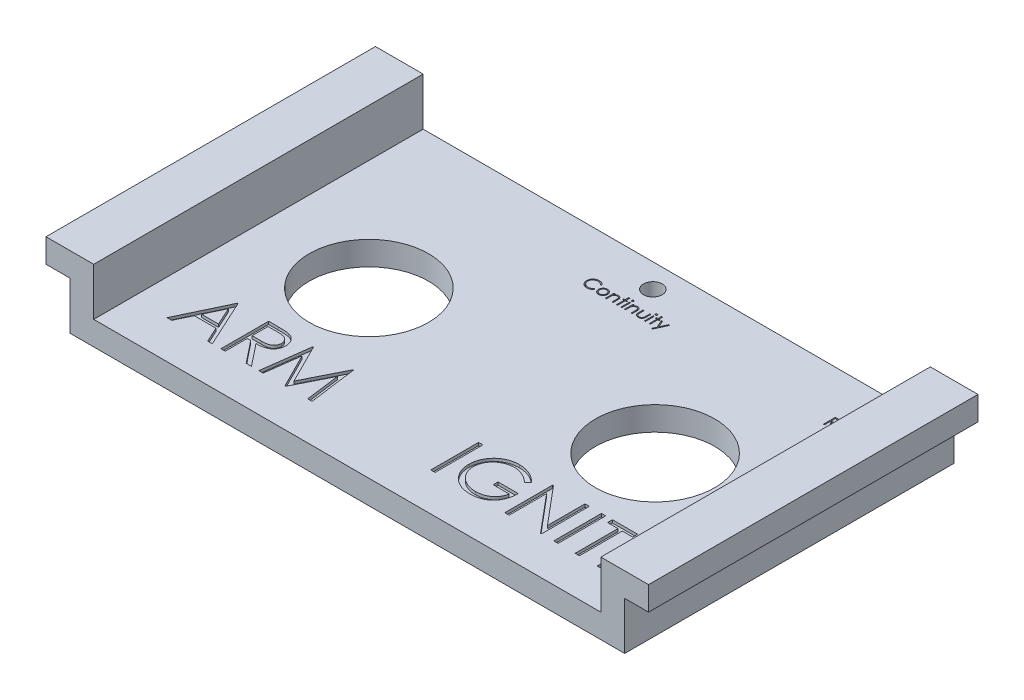
from build123d import *

# Parameters (mm, degrees)
IZIM1_W                     = 147.7
IZIM1_H                     = 87.7
Y_KSEKLIK_EKSTR_ZYON1_DEPTH = 6.35
IZIM2_W                     = 87.700000114
IZIM2_H                     = 12.7
Y_KSEKLIK_EKSTR_ZYON2_DEPTH = 6.35
IZIM3_W                     = 87.7
IZIM3_H                     = 12.7
Y_KSEKLIK_EKSTR_ZYON3_DEPTH = 6.35
IZIM6_W                     = 87.7
IZIM6_H                     = 6.35
Y_KSEKLIK_EKSTR_ZYON4_DEPTH = 6.35
IZIM4_W                     = 87.7
IZIM4_H                     = 6.35
Y_KSEKLIK_EKSTR_ZYON5_DEPTH = 6.35
IZIM7_R                     = 15.875
KES_EKSTR_ZYON1_DEPTH       = 6.35
IZIM8_R                     = 15.875
KES_EKSTR_ZYON2_DEPTH       = 6.35
IZIM9_R                     = 2.5
KES_EKSTR_ZYON3_DEPTH       = 6.35
IZIM10_R                    = 2.5
KES_EKSTR_ZYON4_DEPTH       = 6.35
IZIM11_W                    = 0.284935897
IZIM11_H                    = 2.320192308
KES_EKSTR_ZYON5_DEPTH       = 0.762
IZIM12_W                    = 0.284935897
IZIM12_H                    = 2.320192308
KES_EKSTR_ZYON6_DEPTH       = 0.762
KES_EKSTR_ZYON7_DEPTH       = 0.762
IZIM14_W                    = 1.139743589
IZIM14_H                    = 12.7
KES_EKSTR_ZYON8_DEPTH       = 0.762


with BuildPart() as part:
    # Çizim1 → Yükseklik-Ekstrüzyon1 (new body)
    with BuildSketch(Plane(origin=(0, 0, 0), x_dir=(1, 0, 0), z_dir=(0, 1, 0))):
        Rectangle(IZIM1_W, IZIM1_H)
    extrude(amount=Y_KSEKLIK_EKSTR_ZYON1_DEPTH)

    # Çizim2 → Yükseklik-Ekstrüzyon2 (add)
    with BuildSketch(Plane.ZY.offset(73.85)):
        with Locations((5.7e-08, 12.7)):
            Rectangle(IZIM2_W, IZIM2_H)
    extrude(amount=-Y_KSEKLIK_EKSTR_ZYON2_DEPTH)

    # Çizim3 → Yükseklik-Ekstrüzyon3 (add)
    with BuildSketch(Plane(origin=(73.85, 0, 0), x_dir=(0, 0, -1), z_dir=(1, 0, 0))):
        with Locations((0, 12.7)):
            Rectangle(IZIM3_W, IZIM3_H)
    extrude(amount=-Y_KSEKLIK_EKSTR_ZYON3_DEPTH)

    # Çizim6 → Yükseklik-Ekstrüzyon4 (add)
    with BuildSketch(Plane.ZY.offset(73.85)):
        with Locations((0, 15.875)):
            Rectangle(IZIM6_W, IZIM6_H)
    extrude(amount=Y_KSEKLIK_EKSTR_ZYON4_DEPTH)

    # Çizim4 → Yükseklik-Ekstrüzyon5 (add)
    with BuildSketch(Plane(origin=(73.85, 0, 0), x_dir=(0, 0, -1), z_dir=(1, 0, 0))):
        with Locations((0, 15.875)):
            Rectangle(IZIM4_W, IZIM4_H)
    extrude(amount=Y_KSEKLIK_EKSTR_ZYON5_DEPTH)

    # Çizim7 → Kes-Ekstrüzyon1 (cut)
    with BuildSketch(Plane(origin=(0, 6.35, 0), x_dir=(1, 0, 0), z_dir=(0, 1, 0))):
        with Locations(Location((-38.1, 0, 0), (0, 0, 270))):
            Circle(IZIM7_R)
    extrude(amount=-KES_EKSTR_ZYON1_DEPTH, mode=Mode.SUBTRACT)

    # Çizim8 → Kes-Ekstrüzyon2 (cut)
    with BuildSketch(Plane(origin=(0, 6.35, 0), x_dir=(1, 0, 0), z_dir=(0, 1, 0))):
        with Locations(Location((38.1, 0, 0), (0, 0, 270))):
            Circle(IZIM8_R)
    extrude(amount=-KES_EKSTR_ZYON2_DEPTH, mode=Mode.SUBTRACT)

    # Çizim9 → Kes-Ekstrüzyon3 (cut)
    with BuildSketch(Plane(origin=(0, 6.35, 0), x_dir=(1, 0, 0), z_dir=(0, 1, 0))):
        with Locations(Location((61.15, 37.5, 0), (0, 0, 270))):
            Circle(IZIM9_R)
    extrude(amount=-KES_EKSTR_ZYON3_DEPTH, mode=Mode.SUBTRACT)

    # Çizim10 → Kes-Ekstrüzyon4 (cut)
    with BuildSketch(Plane(origin=(0, 6.35, 0), x_dir=(1, 0, 0), z_dir=(0, 1, 0))):
        with Locations(Location((0, 37.5, 0), (0, 0, 270))):
            Circle(IZIM10_R)
    extrude(amount=-KES_EKSTR_ZYON4_DEPTH, mode=Mode.SUBTRACT)

    # Çizim11 → Kes-Ekstrüzyon5 (cut)
    # profile 1 of 12: a face of its own
    with BuildSketch(Plane(origin=(0, 6.35, 0), x_dir=(1, 0, 0), z_dir=(0, 1, 0))):
        with BuildLine():
            Line((-7.736114872, 31.710407853), (-7.985433783, 31.519602564))
            add(Edge.make_bspline(
                [(-7.985433783, 31.519602564), (-8.003219124, 31.540798837), (-8.038550022, 31.58290561), (-8.09539087, 31.642032768), (-8.154628789, 31.697427684), (-8.216241135, 31.749354246), (-8.281336908, 31.795996598), (-8.348339203, 31.839785384), (-8.418368859, 31.879035404), (-8.515207932, 31.926626827), (-8.64188848, 31.97628941), (-8.801359513, 32.017930199), (-8.967830295, 32.04443798), (-9.081402403, 32.047308943), (-9.13916976, 32.048769231)],
                knots=[0, 0, 0, 0, 0.757959112, 1.505699292, 2.245454638, 2.979532153, 3.711538275, 4.438200793, 5.171680507, 5.909471876, 7.393775596, 8.890124382, 10.418191784, 12, 12, 12, 12], degree=3))
            add(Edge.make_bspline(
                [(-9.13916976, 32.048769231), (-9.170995324, 32.048402779), (-9.234351082, 32.047673277), (-9.328375054, 32.038049285), (-9.420643322, 32.024522687), (-9.511095867, 32.004451858), (-9.59961755, 31.979076696), (-9.686787087, 31.948755071), (-9.771342416, 31.911240323), (-9.854453247, 31.869776402), (-9.934081531, 31.822942934), (-10.009424324, 31.771858679), (-10.080206838, 31.717095284), (-10.146485065, 31.658447495), (-10.208326761, 31.596179431), (-10.265283821, 31.529627492), (-10.317159158, 31.459004449), (-10.364981031, 31.385241573), (-10.407809724, 31.308553719), (-10.443668972, 31.228657048), (-10.475423619, 31.146919754), (-10.500550789, 31.062418344), (-10.520439458, 30.975747406), (-10.534162409, 30.886674334), (-10.543676951, 30.795385211), (-10.544402826, 30.73350962), (-10.544768718, 30.702319912)],
                knots=[0, 0, 0, 0, 1.054917814, 2.100044995, 3.131103042, 4.146048494, 5.169673617, 6.183595914, 7.203665975, 8.234915748, 9.262203917, 10.264457458, 11.251630812, 12.227803204, 13.197192746, 14.159520551, 15.12972552, 16.100847026, 17.073214652, 18.039054194, 19.002613845, 19.979014051, 20.95965708, 21.949030935, 22.966165397, 24, 24, 24, 24], degree=3))
            add(Edge.make_bspline(
                [(-10.544768718, 30.702319912), (-10.543624068, 30.655392215), (-10.5413767, 30.563255905), (-10.521375711, 30.428299709), (-10.490981807, 30.299013097), (-10.445429105, 30.176204241), (-10.38925968, 30.058358801), (-10.318284268, 29.947470699), (-10.236082124, 29.841864244), (-10.141490329, 29.744035284), (-10.03770791, 29.654669262), (-9.926358019, 29.575974091), (-9.807717986, 29.510374162), (-9.683097758, 29.455785982), (-9.551538354, 29.413824522), (-9.413276355, 29.38428421), (-9.268612474, 29.365014518), (-9.169761661, 29.363169672), (-9.119453214, 29.362230769)],
                knots=[0, 0, 0, 0, 1.029171465, 2.020641659, 2.987623507, 3.938342917, 4.889210282, 5.84687017, 6.821220943, 7.821438502, 8.827599549, 9.822697543, 10.807740252, 11.797342354, 12.80366471, 13.83203677, 14.896651826, 16, 16, 16, 16], degree=3))
            add(Edge.make_bspline(
                [(-9.119453214, 29.362230769), (-9.064024346, 29.363762734), (-8.954927074, 29.366778006), (-8.794936079, 29.392322468), (-8.64177792, 29.433740722), (-8.495444359, 29.491705266), (-8.35634793, 29.567057348), (-8.22427096, 29.658404709), (-8.099101964, 29.766616268), (-8.023835158, 29.849241677), (-7.985433783, 29.891397436)],
                knots=[0, 0, 0, 0, 1.028121516, 2.023589091, 2.998037872, 3.967518031, 4.937445131, 5.927275754, 6.942489185, 8, 8, 8, 8], degree=3))
            Line((-7.985433783, 29.891397436), (-7.736114872, 29.7025002))
            add(Edge.make_bspline(
                [(-7.736114872, 29.7025002), (-7.756179158, 29.676611748), (-7.796211622, 29.624958846), (-7.861034251, 29.552140938), (-7.929321514, 29.483647992), (-8.001580622, 29.420032221), (-8.076980333, 29.36002067), (-8.156874502, 29.305318294), (-8.240212839, 29.255161564), (-8.326712973, 29.209235711), (-8.416283001, 29.168489351), (-8.508815595, 29.13360629), (-8.603911903, 29.103557283), (-8.701576271, 29.078835883), (-8.802011279, 29.059539972), (-8.904854495, 29.046640695), (-9.010327882, 29.037803387), (-9.081485457, 29.036997921), (-9.117545161, 29.036589744)],
                knots=[0, 0, 0, 0, 0.986787822, 1.968848986, 2.935600012, 3.899624008, 4.868462664, 5.837806735, 6.815139263, 7.798259679, 8.787526145, 9.778297419, 10.776456485, 11.791383307, 12.812564526, 13.85620153, 14.913611965, 16, 16, 16, 16], degree=3))
            add(Edge.make_bspline(
                [(-9.117545161, 29.036589744), (-9.151693344, 29.036827408), (-9.219217149, 29.037297361), (-9.318911017, 29.044910255), (-9.415965851, 29.055296803), (-9.510104261, 29.070936064), (-9.601839967, 29.089391287), (-9.690341354, 29.114130213), (-9.776479295, 29.141842671), (-9.859907719, 29.174413623), (-9.940697589, 29.211167589), (-10.018588332, 29.252707074), (-10.093544125, 29.298682766), (-10.166301899, 29.34808124), (-10.23578685, 29.402489221), (-10.30260112, 29.461151096), (-10.367119366, 29.523869149), (-10.407036087, 29.569094623), (-10.427105457, 29.591833133)],
                knots=[0, 0, 0, 0, 1.114604814, 2.203992996, 3.262667896, 4.300477797, 5.318619304, 6.316056647, 7.298880507, 8.271930387, 9.238335007, 10.195173496, 11.151986948, 12.108099108, 13.064862484, 14.031167946, 15.010108607, 16, 16, 16, 16], degree=3))
            add(Edge.make_bspline(
                [(-10.427105457, 29.591833133), (-10.459250648, 29.631331212), (-10.523152945, 29.709850513), (-10.604909815, 29.837109939), (-10.674893669, 29.969977528), (-10.73147754, 30.109151321), (-10.775712305, 30.254319022), (-10.806356675, 30.40555381), (-10.826269916, 30.562714444), (-10.828547106, 30.669609245), (-10.829704616, 30.723944511)],
                knots=[0, 0, 0, 0, 0.994628077, 1.977248131, 2.950237994, 3.925870899, 4.908910175, 5.911660606, 6.938484602, 8, 8, 8, 8], degree=3))
            add(Edge.make_bspline(
                [(-10.829704616, 30.723944511), (-10.828293833, 30.781054101), (-10.825518206, 30.893413654), (-10.801936306, 31.058308598), (-10.764000684, 31.216288795), (-10.710119221, 31.367059335), (-10.641806509, 31.511413232), (-10.557418081, 31.648247753), (-10.457934316, 31.778437993), (-10.344135451, 31.900008518), (-10.219342225, 32.011169216), (-10.085703016, 32.108964844), (-9.943479392, 32.190351447), (-9.794238198, 32.25838368), (-9.636861901, 32.310675443), (-9.471686274, 32.347281549), (-9.299021687, 32.370066361), (-9.181217915, 32.372946728), (-9.121361266, 32.374410256)],
                knots=[0, 0, 0, 0, 1.032925535, 2.032216505, 3.007276963, 3.968222605, 4.92396291, 5.891752235, 6.871517503, 7.883894988, 8.900124299, 9.891468569, 10.874487609, 11.85992873, 12.854644235, 13.869047385, 14.917252991, 16, 16, 16, 16], degree=3))
            add(Edge.make_bspline(
                [(-9.121361266, 32.374410256), (-9.084880996, 32.373972888), (-9.012671973, 32.373107162), (-8.905853495, 32.364665162), (-8.801856527, 32.350592104), (-8.700609422, 32.331436813), (-8.60161962, 32.307663028), (-8.505643688, 32.2766929), (-8.41211845, 32.24128119), (-8.321633755, 32.200497439), (-8.234623742, 32.154716895), (-8.15111551, 32.104447007), (-8.071772388, 32.049750098), (-7.996036076, 31.99109136), (-7.925173513, 31.92722981), (-7.857172743, 31.859921991), (-7.79434305, 31.787229165), (-7.755559795, 31.736061832), (-7.736114872, 31.710407853)],
                knots=[0, 0, 0, 0, 1.096760587, 2.17092713, 3.219439832, 4.250915756, 5.268269357, 6.278326846, 7.281116186, 8.274029601, 9.260640565, 10.235837813, 11.203064059, 12.156899882, 13.114053108, 14.069676657, 15.032185724, 16, 16, 16, 16], degree=3))
        make_face()
    # profile 2 of 12: a face of its own
    with BuildSketch(Plane(origin=(0, 6.35, 0), x_dir=(1, 0, 0), z_dir=(0, 1, 0))):
        with BuildLine():
            add(Edge.make_bspline(
                [(-6.045580016, 31.478897436), (-6.002045076, 31.477970435), (-5.916683697, 31.476152812), (-5.791672258, 31.456726379), (-5.672342028, 31.427019841), (-5.558235982, 31.385952067), (-5.450815485, 31.330904869), (-5.348515857, 31.265219298), (-5.25161757, 31.187402231), (-5.193539536, 31.127205983), (-5.164059584, 31.096650841)],
                knots=[0, 0, 0, 0, 1.054011418, 2.066658804, 3.057071809, 4.030435133, 4.997543892, 5.974964718, 6.972108034, 8, 8, 8, 8], degree=3))
            add(Edge.make_bspline(
                [(-5.164059584, 31.096650841), (-5.138675954, 31.067428154), (-5.088399938, 31.00954832), (-5.023933178, 30.915699299), (-4.968396477, 30.818507922), (-4.923889363, 30.716683562), (-4.88879652, 30.61111511), (-4.86388121, 30.501439714), (-4.849061276, 30.387899585), (-4.84706287, 30.31078896), (-4.84605077, 30.271735978)],
                knots=[0, 0, 0, 0, 1.025258237, 2.030674902, 3.01204498, 3.988269485, 4.97094183, 5.956517959, 6.965070386, 8, 8, 8, 8], degree=3))
            add(Edge.make_bspline(
                [(-4.84605077, 30.271735978), (-4.846940983, 30.23245664), (-4.848700086, 30.154838836), (-4.865340366, 30.040521268), (-4.891222137, 29.929673108), (-4.928262447, 29.822758435), (-4.975758732, 29.719450442), (-5.033716713, 29.620200351), (-5.102543108, 29.524812344), (-5.18056102, 29.434096391), (-5.26678665, 29.350488468), (-5.360327728, 29.277619252), (-5.45934603, 29.215188297), (-5.565158214, 29.164899549), (-5.676798006, 29.125248606), (-5.794506204, 29.097399306), (-5.918099946, 29.080561207), (-6.002488925, 29.078398966), (-6.045580016, 29.077294872)],
                knots=[0, 0, 0, 0, 0.998656419, 1.973391657, 2.932242238, 3.890759089, 4.846373663, 5.82037756, 6.809684879, 7.83454468, 8.860553229, 9.859544525, 10.845671541, 11.83227036, 12.833544569, 13.85385346, 14.904124723, 16, 16, 16, 16], degree=3))
            add(Edge.make_bspline(
                [(-6.045580016, 29.077294872), (-6.088882226, 29.078402671), (-6.173691792, 29.080572352), (-6.29772179, 29.097333887), (-6.415640944, 29.125235772), (-6.527426887, 29.165029854), (-6.633693998, 29.215189905), (-6.733286035, 29.277430509), (-6.826903101, 29.350510078), (-6.913146973, 29.434090535), (-6.991159993, 29.524813853), (-7.059987651, 29.620199959), (-7.117945304, 29.719450544), (-7.165441674, 29.822758408), (-7.202481962, 29.929673115), (-7.228363739, 30.040521266), (-7.245004018, 30.154838836), (-7.246763121, 30.23245664), (-7.247653334, 30.271735978)],
                knots=[0, 0, 0, 0, 1.099876186, 2.154163076, 3.173186993, 4.173200201, 5.163417411, 6.152872554, 7.150605724, 8.17532212, 9.198891216, 10.186952605, 11.159729845, 12.11414092, 13.071450619, 14.029093627, 15.002601286, 16, 16, 16, 16], degree=3))
            add(Edge.make_bspline(
                [(-7.247653334, 30.271735978), (-7.246634331, 30.310576701), (-7.24461688, 30.387474659), (-7.229811847, 30.50080135), (-7.204993728, 30.610291124), (-7.169858818, 30.715452092), (-7.124941466, 30.816830237), (-7.070185155, 30.914261763), (-7.005060796, 31.00768641), (-6.95498474, 31.06549144), (-6.92964452, 31.094742788)],
                knots=[0, 0, 0, 0, 1.031353054, 2.041901799, 3.029428768, 4.008703097, 4.981709435, 5.96992636, 6.972712378, 8, 8, 8, 8], degree=3))
            add(Edge.make_bspline(
                [(-6.92964452, 31.094742788), (-6.900209012, 31.125562912), (-6.842318907, 31.186176108), (-6.744938275, 31.263766326), (-6.642890309, 31.330818764), (-6.534282698, 31.384772189), (-6.420270391, 31.427261415), (-6.300328649, 31.45680299), (-6.174893003, 31.476082819), (-6.089113918, 31.47794988), (-6.045580016, 31.478897436)],
                knots=[0, 0, 0, 0, 1.027980169, 2.021703884, 2.998553061, 3.971491411, 4.943284454, 5.930300938, 6.949603206, 8, 8, 8, 8], degree=3))
        make_face()
        with BuildLine():
            add(Edge.make_bspline(
                [(-6.046852052, 31.193961538), (-6.077638313, 31.193086516), (-6.138416094, 31.19135906), (-6.227878146, 31.178220089), (-6.314002429, 31.157403425), (-6.396952337, 31.127826888), (-6.476448144, 31.089637172), (-6.552565959, 31.042730303), (-6.625529672, 30.987727549), (-6.693911973, 30.924714983), (-6.756670213, 30.855881895), (-6.811532377, 30.782540884), (-6.858182295, 30.705881555), (-6.897044439, 30.625824192), (-6.925988817, 30.541557503), (-6.947010059, 30.454035787), (-6.960136634, 30.363080731), (-6.961847849, 30.30124895), (-6.962717436, 30.269827925)],
                knots=[0, 0, 0, 0, 1.021534396, 2.016698045, 2.994645724, 3.958388632, 4.93408049, 5.916473867, 6.921342795, 7.962252576, 8.998418191, 10.008913653, 10.997312074, 11.973003931, 12.956656626, 13.948281152, 14.957379055, 16, 16, 16, 16], degree=3))
            add(Edge.make_bspline(
                [(-6.962717436, 30.269827925), (-6.961259818, 30.229231443), (-6.958366717, 30.148655018), (-6.934839753, 30.029990642), (-6.895482199, 29.916069962), (-6.842335167, 29.807560812), (-6.77574524, 29.707165246), (-6.697289115, 29.617656113), (-6.607808815, 29.540380413), (-6.50837099, 29.476262789), (-6.401006716, 29.425317867), (-6.287381339, 29.389214511), (-6.168871567, 29.36574519), (-6.087881189, 29.363412495), (-6.046852052, 29.362230769)],
                knots=[0, 0, 0, 0, 1.016792936, 2.018143844, 3.017858371, 4.030088057, 5.03801393, 6.028138512, 7.003788237, 7.991172063, 8.984598303, 9.972568034, 10.972917682, 12, 12, 12, 12], degree=3))
            add(Edge.make_bspline(
                [(-6.046852052, 29.362230769), (-6.005825274, 29.363419381), (-5.924839555, 29.365765666), (-5.806494445, 29.38909631), (-5.693179627, 29.425476059), (-5.585926869, 29.476205493), (-5.486534307, 29.540623898), (-5.396410461, 29.617219754), (-5.318624221, 29.707402319), (-5.252100165, 29.807693792), (-5.198082763, 29.91590174), (-5.15890943, 30.030011668), (-5.135325905, 30.148649663), (-5.132440439, 30.229229649), (-5.130986667, 30.269827925)],
                knots=[0, 0, 0, 0, 1.02726834, 2.027799167, 3.010890988, 4.004497153, 4.992059811, 5.971914811, 6.958719428, 7.966827853, 8.981595046, 9.981490638, 10.983022906, 12, 12, 12, 12], degree=3))
            add(Edge.make_bspline(
                [(-5.130986667, 30.269827925), (-5.131855955, 30.301249138), (-5.133566581, 30.363081288), (-5.146697441, 30.454033657), (-5.167702824, 30.541565319), (-5.196705648, 30.625795351), (-5.235398932, 30.706088837), (-5.282948451, 30.782315804), (-5.337586596, 30.856135956), (-5.401102127, 30.924492473), (-5.469413048, 30.987752114), (-5.542406333, 31.042751631), (-5.618411278, 31.089431021), (-5.697676135, 31.12815354), (-5.780636678, 31.157134341), (-5.866640288, 31.178340285), (-5.955720637, 31.191303535), (-6.016280627, 31.193069871), (-6.046852052, 31.193961538)],
                knots=[0, 0, 0, 0, 1.042956736, 2.052379634, 3.044323526, 4.02829302, 5.004299113, 5.996692471, 7.007513377, 8.048758398, 9.090003419, 10.095195979, 11.07790575, 12.047570684, 13.018257071, 13.989683339, 14.985167495, 16, 16, 16, 16], degree=3))
        make_face(mode=Mode.SUBTRACT)
    # profile 3 of 12: a face of its own
    with BuildSketch(Plane(origin=(0, 6.35, 0), x_dir=(1, 0, 0), z_dir=(0, 1, 0))):
        with BuildLine():
            Line((-4.276178975, 31.438192308), (-3.991243077, 31.438192308))
            Line((-3.991243077, 31.438192308), (-3.991243077, 31.019692708))
            add(Edge.make_bspline(
                [(-3.991243077, 31.019692708), (-3.960819651, 31.057650035), (-3.901781931, 31.131307553), (-3.803461858, 31.22811836), (-3.699554177, 31.307897243), (-3.590695216, 31.371491399), (-3.4767372, 31.419430838), (-3.358374769, 31.45405279), (-3.234899286, 31.474812599), (-3.150930118, 31.477525165), (-3.108450609, 31.478897436)],
                knots=[0, 0, 0, 0, 1.12780773, 2.188550248, 3.19190651, 4.159438251, 5.104880172, 6.052711206, 7.014878035, 8, 8, 8, 8], degree=3))
            add(Edge.make_bspline(
                [(-3.108450609, 31.478897436), (-3.065514963, 31.477314294), (-2.981479546, 31.474215704), (-2.859125876, 31.449707706), (-2.744850011, 31.407847367), (-2.639059414, 31.350504989), (-2.543694014, 31.279197688), (-2.459942184, 31.196123558), (-2.39066981, 31.100568682), (-2.344226488, 31.011919819), (-2.313632507, 30.933280699), (-2.294371744, 30.86592829), (-2.278015068, 30.79089111), (-2.263834839, 30.708395911), (-2.254239888, 30.617864696), (-2.246672238, 30.519668575), (-2.241248708, 30.413839357), (-2.241033527, 30.340645059), (-2.240922565, 30.302900841)],
                knots=[0, 0, 0, 0, 1.235846778, 2.418850247, 3.575807741, 4.728682307, 5.871620074, 6.994088408, 8.11269785, 9.256955736, 9.865816715, 10.540099792, 11.271859618, 12.076849838, 12.949306005, 13.892391288, 14.913166135, 16, 16, 16, 16], degree=3))
            Line((-2.240922565, 30.302900841), (-2.240922565, 29.118))
            Line((-2.240922565, 29.118), (-2.525858462, 29.118))
            Line((-2.525858462, 29.118), (-2.525858462, 30.20940625))
            add(Edge.make_bspline(
                [(-2.525858462, 30.20940625), (-2.526033729, 30.240995182), (-2.526368986, 30.301419433), (-2.527426394, 30.387932762), (-2.52997529, 30.466388443), (-2.533556974, 30.536598912), (-2.53879938, 30.59849675), (-2.544262767, 30.652208022), (-2.550943853, 30.697664536), (-2.556897353, 30.725028575), (-2.559567396, 30.737300881)],
                knots=[0, 0, 0, 0, 1.430800155, 2.736877192, 3.918605307, 4.986035426, 5.920637409, 6.731861385, 7.431261377, 8, 8, 8, 8], degree=3))
            add(Edge.make_bspline(
                [(-2.559567396, 30.737300881), (-2.569206271, 30.773324599), (-2.587758123, 30.84265911), (-2.633599665, 30.936706559), (-2.691488244, 31.016714915), (-2.762152721, 31.082189512), (-2.844910526, 31.133144486), (-2.939532005, 31.16849943), (-3.045104058, 31.190612189), (-3.119357676, 31.192813944), (-3.158059984, 31.193961538)],
                knots=[0, 0, 0, 0, 1.084156227, 2.086665306, 3.027808233, 3.945421172, 4.874247719, 5.839848303, 6.874090471, 8, 8, 8, 8], degree=3))
            add(Edge.make_bspline(
                [(-3.158059984, 31.193961538), (-3.180981383, 31.193529734), (-3.226342239, 31.192675205), (-3.293606856, 31.184101527), (-3.358852356, 31.1700785), (-3.422733546, 31.151147664), (-3.483972759, 31.125146892), (-3.544537509, 31.095638106), (-3.602147216, 31.058855085), (-3.658030298, 31.017860735), (-3.710021202, 30.97243174), (-3.758397623, 30.92449422), (-3.801521399, 30.873444208), (-3.84059084, 30.820104256), (-3.874316836, 30.763741803), (-3.903756423, 30.704900611), (-3.928735232, 30.643503233), (-3.941147388, 30.600890141), (-3.947357861, 30.57956851)],
                knots=[0, 0, 0, 0, 1.023777757, 2.026029729, 3.023749952, 4.003683103, 4.997618607, 5.993177895, 7.010360494, 8.046726602, 9.087585522, 10.09234134, 11.086953743, 12.070360549, 13.043493632, 14.017870808, 15.008233677, 16, 16, 16, 16], degree=3))
            add(Edge.make_bspline(
                [(-3.947357861, 30.57956851), (-3.950931685, 30.563915575), (-3.958711713, 30.529839956), (-3.967114741, 30.473919662), (-3.974741613, 30.409231327), (-3.981125139, 30.33585044), (-3.985030767, 30.253520082), (-3.989289256, 30.162591857), (-3.990839618, 30.062703193), (-3.991104825, 29.993160086), (-3.991243077, 29.956907252)],
                knots=[0, 0, 0, 0, 0.615963638, 1.340920617, 2.168419149, 3.115676021, 4.16674242, 5.331190069, 6.6087489, 8, 8, 8, 8], degree=3))
            Line((-3.991243077, 29.956907252), (-3.991243077, 29.118))
            Line((-3.991243077, 29.118), (-4.276178975, 29.118))
            Line((-4.276178975, 29.118), (-4.276178975, 31.438192308))
        make_face()
    # profile 4 of 12: a face of its own
    with BuildSketch(Plane(origin=(0, 6.35, 0), x_dir=(1, 0, 0), z_dir=(0, 1, 0))):
        Polygon((-1.304704616, 32.374410256), (-1.019768718, 32.374410256), (-1.019768718, 31.438192308), (-0.612717436, 31.438192308), (-0.612717436, 31.15325641), (-1.019768718, 31.15325641), (-1.019768718, 29.118), (-1.304704616, 29.118), (-1.304704616, 31.15325641), (-1.711755898, 31.15325641), (-1.711755898, 31.438192308), (-1.304704616, 31.438192308), align=None)
    # profile 5 of 12: a face of its own
    with BuildSketch(Plane(origin=(0, 6.35, 0), x_dir=(1, 0, 0), z_dir=(0, 1, 0))):
        with BuildLine():
            add(Edge.make_bspline(
                [(-0.023765113, 32.415115385), (-0.006083705, 32.414295189), (0.028539888, 32.412689089), (0.078608066, 32.398935463), (0.124198356, 32.375622177), (0.164636728, 32.344344181), (0.199336654, 32.307560043), (0.223630584, 32.264687593), (0.239244686, 32.218370114), (0.241130233, 32.18606214), (0.242090256, 32.16961258)],
                knots=[0, 0, 0, 0, 1.055194115, 2.066272739, 3.074728998, 4.095836921, 5.109056067, 6.073838105, 7.019297344, 8, 8, 8, 8], degree=3))
            add(Edge.make_bspline(
                [(0.242090256, 32.16961258), (0.241108582, 32.15359003), (0.23916793, 32.121915346), (0.223642644, 32.076400839), (0.199129614, 32.034124096), (0.164658979, 31.997411381), (0.12419246, 31.966150675), (0.078609633, 31.942832805), (0.028539476, 31.929080395), (-0.006083844, 31.927474127), (-0.023765113, 31.926653846)],
                knots=[0, 0, 0, 0, 0.96129708, 1.900370562, 2.859976407, 3.87933698, 4.906634145, 5.921202961, 6.938410037, 8, 8, 8, 8], degree=3))
            add(Edge.make_bspline(
                [(-0.023765113, 31.926653846), (-0.041244191, 31.927442807), (-0.075264933, 31.928978415), (-0.124583426, 31.943102646), (-0.169784984, 31.966158655), (-0.210302223, 31.997206694), (-0.244075326, 32.034349565), (-0.268657379, 32.076375039), (-0.284146808, 32.121921915), (-0.286092293, 32.153592237), (-0.287076411, 32.16961258)],
                knots=[0, 0, 0, 0, 1.054934014, 2.053291228, 3.073705704, 4.106921865, 5.123545215, 6.088680038, 7.033164197, 8, 8, 8, 8], degree=3))
            add(Edge.make_bspline(
                [(-0.287076411, 32.16961258), (-0.286113854, 32.186059851), (-0.284223331, 32.218363328), (-0.268645768, 32.264713822), (-0.244280085, 32.307332756), (-0.21027986, 32.344548745), (-0.169790935, 32.375614247), (-0.124581888, 32.398665637), (-0.075265339, 32.412791066), (-0.041244329, 32.414326509), (-0.023765113, 32.415115385)],
                knots=[0, 0, 0, 0, 0.98631895, 1.937192651, 2.907499808, 3.917963147, 4.944918757, 5.95915025, 6.951458133, 8, 8, 8, 8], degree=3))
        make_face()
    # profile 6 of 12: a face of its own
    with BuildSketch(Plane(origin=(0, 6.35, 0), x_dir=(1, 0, 0), z_dir=(0, 1, 0))):
        with Locations((-0.022493077, 30.278096154)):
            Rectangle(IZIM11_W, IZIM11_H)
    # profile 7 of 12: a face of its own
    with BuildSketch(Plane(origin=(0, 6.35, 0), x_dir=(1, 0, 0), z_dir=(0, 1, 0))):
        with BuildLine():
            Line((0.811962051, 31.438192308), (1.096897948, 31.438192308))
            Line((1.096897948, 31.438192308), (1.096897948, 31.019692708))
            add(Edge.make_bspline(
                [(1.096897948, 31.019692708), (1.127321374, 31.057650035), (1.186359094, 31.131307553), (1.284679168, 31.22811836), (1.388586849, 31.307897243), (1.497445809, 31.371491399), (1.611403826, 31.419430838), (1.729766256, 31.45405279), (1.85324174, 31.474812599), (1.937210907, 31.477525165), (1.979690416, 31.478897436)],
                knots=[0, 0, 0, 0, 1.12780773, 2.188550248, 3.19190651, 4.159438251, 5.104880172, 6.052711206, 7.014878035, 8, 8, 8, 8], degree=3))
            add(Edge.make_bspline(
                [(1.979690416, 31.478897436), (2.022626063, 31.477314294), (2.10666148, 31.474215704), (2.22901515, 31.449707706), (2.343291014, 31.407847367), (2.449081611, 31.350504989), (2.544447012, 31.279197688), (2.628198842, 31.196123558), (2.697471216, 31.100568682), (2.743914538, 31.011919819), (2.774508519, 30.933280699), (2.793769282, 30.86592829), (2.810125958, 30.79089111), (2.824306186, 30.708395911), (2.833901138, 30.617864696), (2.841468788, 30.519668575), (2.846892318, 30.413839357), (2.847107499, 30.340645059), (2.847218461, 30.302900841)],
                knots=[0, 0, 0, 0, 1.235846778, 2.418850247, 3.575807741, 4.728682307, 5.871620074, 6.994088408, 8.11269785, 9.256955736, 9.865816715, 10.540099792, 11.271859618, 12.076849838, 12.949306005, 13.892391288, 14.913166135, 16, 16, 16, 16], degree=3))
            Line((2.847218461, 30.302900841), (2.847218461, 29.118))
            Line((2.847218461, 29.118), (2.562282564, 29.118))
            Line((2.562282564, 29.118), (2.562282564, 30.20940625))
            add(Edge.make_bspline(
                [(2.562282564, 30.20940625), (2.562107296, 30.240995182), (2.56177204, 30.301419433), (2.560714632, 30.387932762), (2.558165736, 30.466388443), (2.554584052, 30.536598912), (2.549341646, 30.59849675), (2.543878259, 30.652208022), (2.537197173, 30.697664536), (2.531243673, 30.725028575), (2.528573629, 30.737300881)],
                knots=[0, 0, 0, 0, 1.430800155, 2.736877192, 3.918605307, 4.986035426, 5.920637409, 6.731861385, 7.431261377, 8, 8, 8, 8], degree=3))
            add(Edge.make_bspline(
                [(2.528573629, 30.737300881), (2.518934754, 30.773324599), (2.500382902, 30.84265911), (2.45454136, 30.936706559), (2.396652782, 31.016714915), (2.325988304, 31.082189512), (2.2432305, 31.133144486), (2.148609021, 31.16849943), (2.043036968, 31.190612189), (1.968783349, 31.192813944), (1.930081041, 31.193961538)],
                knots=[0, 0, 0, 0, 1.084156227, 2.086665306, 3.027808233, 3.945421172, 4.874247719, 5.839848303, 6.874090471, 8, 8, 8, 8], degree=3))
            add(Edge.make_bspline(
                [(1.930081041, 31.193961538), (1.907159643, 31.193529734), (1.861798787, 31.192675205), (1.794534169, 31.184101527), (1.729288669, 31.1700785), (1.66540748, 31.151147664), (1.604168267, 31.125146892), (1.543603517, 31.095638106), (1.48599381, 31.058855085), (1.430110728, 31.017860735), (1.378119824, 30.97243174), (1.329743403, 30.92449422), (1.286619627, 30.873444208), (1.247550186, 30.820104256), (1.21382419, 30.763741803), (1.184384603, 30.704900611), (1.159405794, 30.643503233), (1.146993637, 30.600890141), (1.140783165, 30.57956851)],
                knots=[0, 0, 0, 0, 1.023777757, 2.026029729, 3.023749952, 4.003683103, 4.997618607, 5.993177895, 7.010360494, 8.046726602, 9.087585522, 10.09234134, 11.086953743, 12.070360549, 13.043493632, 14.017870808, 15.008233677, 16, 16, 16, 16], degree=3))
            add(Edge.make_bspline(
                [(1.140783165, 30.57956851), (1.137209341, 30.563915575), (1.129429312, 30.529839956), (1.121026285, 30.473919662), (1.113399413, 30.409231327), (1.107015886, 30.33585044), (1.103110259, 30.253520082), (1.09885177, 30.162591857), (1.097301407, 30.062703193), (1.097036201, 29.993160086), (1.096897948, 29.956907252)],
                knots=[0, 0, 0, 0, 0.615963638, 1.340920617, 2.168419149, 3.115676021, 4.16674242, 5.331190069, 6.6087489, 8, 8, 8, 8], degree=3))
            Line((1.096897948, 29.956907252), (1.096897948, 29.118))
            Line((1.096897948, 29.118), (0.811962051, 29.118))
            Line((0.811962051, 29.118), (0.811962051, 31.438192308))
        make_face()
    # profile 8 of 12: a face of its own
    with BuildSketch(Plane(origin=(0, 6.35, 0), x_dir=(1, 0, 0), z_dir=(0, 1, 0))):
        with BuildLine():
            Line((3.457795384, 31.438192308), (3.742731282, 31.438192308))
            Line((3.742731282, 31.438192308), (3.742731282, 30.362050481))
            add(Edge.make_bspline(
                [(3.742731282, 30.362050481), (3.74286001, 30.330461273), (3.74310626, 30.270032597), (3.744776257, 30.183078249), (3.74870427, 30.103778803), (3.753615382, 30.032088448), (3.759931034, 29.968019315), (3.767445226, 29.911795184), (3.775843937, 29.86277846), (3.784065113, 29.833256987), (3.787888533, 29.819527444)],
                knots=[0, 0, 0, 0, 1.388932606, 2.656963016, 3.823490214, 4.879454478, 5.816252168, 6.653371382, 7.373723809, 8, 8, 8, 8], degree=3))
            add(Edge.make_bspline(
                [(3.787888533, 29.819527444), (3.794022139, 29.802270982), (3.806161834, 29.768116817), (3.828181351, 29.718778219), (3.855421342, 29.673080642), (3.8852299, 29.629261947), (3.919610077, 29.588620145), (3.958126883, 29.551223867), (3.999490998, 29.515660155), (4.060954484, 29.473582523), (4.145009675, 29.428483616), (4.255366103, 29.389570981), (4.375022079, 29.36631563), (4.457721503, 29.363617556), (4.500228277, 29.362230769)],
                knots=[0, 0, 0, 0, 0.725840625, 1.436591201, 2.137033971, 2.831655856, 3.53531722, 4.242432219, 4.957935707, 5.694543706, 7.190802206, 8.724350549, 10.316345118, 12, 12, 12, 12], degree=3))
            add(Edge.make_bspline(
                [(4.500228277, 29.362230769), (4.542731102, 29.363647045), (4.624966204, 29.366387276), (4.743307497, 29.388869486), (4.851485566, 29.426430361), (4.948414643, 29.478869942), (5.033655084, 29.543043099), (5.104688378, 29.618343946), (5.163296388, 29.702390176), (5.188886362, 29.765095772), (5.201755721, 29.796630809)],
                knots=[0, 0, 0, 0, 1.157059328, 2.238695713, 3.266970494, 4.264342957, 5.228770407, 6.160125903, 7.074715775, 8, 8, 8, 8], degree=3))
            add(Edge.make_bspline(
                [(5.201755721, 29.796630809), (5.205560487, 29.809300237), (5.213971895, 29.837309249), (5.223009171, 29.884825163), (5.231150289, 29.941489483), (5.238101885, 30.007673001), (5.243059568, 30.083202761), (5.245732035, 30.168055158), (5.248751256, 30.261963821), (5.248797082, 30.327702431), (5.248821025, 30.362050481)],
                knots=[0, 0, 0, 0, 0.557542046, 1.232589297, 2.036731608, 2.971723315, 4.038036528, 5.22795436, 6.551621927, 8, 8, 8, 8], degree=3))
            Line((5.248821025, 30.362050481), (5.248821025, 31.438192308))
            Line((5.248821025, 31.438192308), (5.533756923, 31.438192308))
            Line((5.533756923, 31.438192308), (5.533756923, 30.308625))
            add(Edge.make_bspline(
                [(5.533756923, 30.308625), (5.533356242, 30.270246352), (5.532578868, 30.195786524), (5.52758292, 30.087578794), (5.519010772, 29.986738758), (5.505999908, 29.893213037), (5.490700331, 29.807073036), (5.470964284, 29.728208352), (5.447398311, 29.656861971), (5.420814022, 29.591781931), (5.389407042, 29.532775105), (5.355999674, 29.4767719), (5.317423631, 29.425161881), (5.276810633, 29.375375942), (5.231633416, 29.329890413), (5.182738544, 29.287661575), (5.130814213, 29.248043896), (5.074708155, 29.212582521), (5.015239441, 29.180635993), (4.952334656, 29.15231855), (4.885223322, 29.129909784), (4.814771309, 29.110577966), (4.740633445, 29.095415554), (4.662881202, 29.084723455), (4.581540772, 29.078169047), (4.526105762, 29.077591157), (4.497684206, 29.077294872)],
                knots=[0, 0, 0, 0, 1.493040784, 2.896703357, 4.213163133, 5.428574705, 6.569057535, 7.615249723, 8.588095153, 9.490268104, 10.346124644, 11.18633936, 12.024365274, 12.850166724, 13.684164916, 14.514361689, 15.362232829, 16.222528818, 17.093394965, 17.986930858, 18.902426812, 19.842810585, 20.827885679, 21.843828298, 22.894529745, 24, 24, 24, 24], degree=3))
            add(Edge.make_bspline(
                [(4.497684206, 29.077294872), (4.469475226, 29.077603035), (4.414041953, 29.078208604), (4.332697324, 29.084687243), (4.25472966, 29.095398941), (4.180416155, 29.110689031), (4.109682238, 29.129774473), (4.042241391, 29.152456252), (3.978883302, 29.180650689), (3.91884677, 29.21238033), (3.862601746, 29.248271687), (3.809888965, 29.287612694), (3.760779106, 29.330344623), (3.715261337, 29.376289011), (3.673974565, 29.426015804), (3.636404299, 29.47912499), (3.601972145, 29.535090342), (3.570809257, 29.595019068), (3.544037878, 29.660852249), (3.520402048, 29.733693187), (3.501070255, 29.81434047), (3.485338158, 29.902725148), (3.472682209, 29.998424221), (3.463895494, 30.101991284), (3.458982562, 30.213174061), (3.458199642, 30.289963605), (3.457795384, 30.329613582)],
                knots=[0, 0, 0, 0, 1.083640291, 2.129454052, 3.13281866, 4.105697902, 5.042300162, 5.946461698, 6.836384745, 7.703652036, 8.553297018, 9.397182691, 10.228592656, 11.052265423, 11.879314572, 12.708807002, 13.549817954, 14.402308542, 15.300838682, 16.27712199, 17.341985831, 18.484375296, 19.725102775, 21.0496083, 22.476576903, 24, 24, 24, 24], degree=3))
            Line((3.457795384, 30.329613582), (3.457795384, 31.438192308))
        make_face()
    # profile 9 of 12: a face of its own
    with BuildSketch(Plane(origin=(0, 6.35, 0), x_dir=(1, 0, 0), z_dir=(0, 1, 0))):
        with BuildLine():
            add(Edge.make_bspline(
                [(6.285529759, 32.415115385), (6.303211167, 32.414295189), (6.33783476, 32.412689089), (6.387902938, 32.398935463), (6.433493228, 32.375622177), (6.4739316, 32.344344181), (6.508631525, 32.307560043), (6.532925456, 32.264687593), (6.548539558, 32.218370114), (6.550425104, 32.18606214), (6.551385128, 32.16961258)],
                knots=[0, 0, 0, 0, 1.055194115, 2.066272739, 3.074728998, 4.095836921, 5.109056067, 6.073838105, 7.019297344, 8, 8, 8, 8], degree=3))
            add(Edge.make_bspline(
                [(6.551385128, 32.16961258), (6.550403454, 32.15359003), (6.548462802, 32.121915346), (6.532937516, 32.076400839), (6.508424486, 32.034124096), (6.473953851, 31.997411381), (6.433487332, 31.966150675), (6.387904504, 31.942832805), (6.337834348, 31.929080395), (6.303211028, 31.927474127), (6.285529759, 31.926653846)],
                knots=[0, 0, 0, 0, 0.96129708, 1.900370562, 2.859976407, 3.87933698, 4.906634145, 5.921202961, 6.938410037, 8, 8, 8, 8], degree=3))
            add(Edge.make_bspline(
                [(6.285529759, 31.926653846), (6.268050681, 31.927442807), (6.234029939, 31.928978415), (6.184711446, 31.943102646), (6.139509888, 31.966158655), (6.098992649, 31.997206694), (6.065219545, 32.034349565), (6.040637493, 32.076375039), (6.025148063, 32.121921915), (6.023202579, 32.153592237), (6.022218461, 32.16961258)],
                knots=[0, 0, 0, 0, 1.054934014, 2.053291228, 3.073705704, 4.106921865, 5.123545215, 6.088680038, 7.033164197, 8, 8, 8, 8], degree=3))
            add(Edge.make_bspline(
                [(6.022218461, 32.16961258), (6.023181018, 32.186059851), (6.025071541, 32.218363328), (6.040649104, 32.264713822), (6.065014786, 32.307332756), (6.099015012, 32.344548745), (6.139503937, 32.375614247), (6.184712984, 32.398665637), (6.234029533, 32.412791066), (6.268050543, 32.414326509), (6.285529759, 32.415115385)],
                knots=[0, 0, 0, 0, 0.98631895, 1.937192651, 2.907499808, 3.917963147, 4.944918757, 5.95915025, 6.951458133, 8, 8, 8, 8], degree=3))
        make_face()
    # profile 10 of 12: a face of its own
    with BuildSketch(Plane(origin=(0, 6.35, 0), x_dir=(1, 0, 0), z_dir=(0, 1, 0))):
        with Locations((6.286801795, 30.278096154)):
            Rectangle(IZIM11_W, IZIM11_H)
    # profile 11 of 12: a face of its own
    with BuildSketch(Plane(origin=(0, 6.35, 0), x_dir=(1, 0, 0), z_dir=(0, 1, 0))):
        Polygon((7.40619282, 32.374410256), (7.691128717, 32.374410256), (7.691128717, 31.438192308), (8.09818, 31.438192308), (8.09818, 31.15325641), (7.691128717, 31.15325641), (7.691128717, 29.118), (7.40619282, 29.118), (7.40619282, 31.15325641), (6.999141538, 31.15325641), (6.999141538, 31.438192308), (7.40619282, 31.438192308), align=None)
    # profile 12 of 12: a face of its own
    with BuildSketch(Plane(origin=(0, 6.35, 0), x_dir=(1, 0, 0), z_dir=(0, 1, 0))):
        Polygon((8.342410769, 31.438192308), (8.649607283, 31.438192308), (9.435089054, 29.661159054), (10.23265516, 31.438192308), (10.540487692, 31.438192308), (9.115808205, 28.263192308), (8.807975673, 28.263192308), (9.28053677, 29.315801482), align=None)
    extrude(amount=-KES_EKSTR_ZYON5_DEPTH, mode=Mode.SUBTRACT)

    # Çizim12 → Kes-Ekstrüzyon6 (cut)
    # profile 1 of 6: a face of its own
    with BuildSketch(Plane(origin=(0, 6.35, 0), x_dir=(1, 0, 0), z_dir=(0, 1, 0))):
        with BuildLine():
            Line((53.795098431, 32.293), (54.430480042, 32.293))
            add(Edge.make_bspline(
                [(54.430480042, 32.293), (54.472880923, 32.292858861), (54.554295311, 32.292587859), (54.670929635, 32.291076774), (54.776908501, 32.286745752), (54.872176498, 32.28301868), (54.956731878, 32.276222418), (55.030833921, 32.269726689), (55.094141332, 32.261223439), (55.132464354, 32.253326377), (55.149815979, 32.249750801)],
                knots=[0, 0, 0, 0, 1.410062039, 2.707475311, 3.878576406, 4.937260626, 5.877586885, 6.699081471, 7.410979367, 8, 8, 8, 8], degree=3))
            add(Edge.make_bspline(
                [(55.149815979, 32.249750801), (55.173044846, 32.244011521), (55.219007043, 32.232655396), (55.285183175, 32.208652758), (55.348242597, 32.180876384), (55.407923366, 32.148252152), (55.463926548, 32.110537888), (55.516829587, 32.068384662), (55.566872543, 32.022023126), (55.612031594, 31.970284377), (55.654612019, 31.916004114), (55.690524559, 31.857308563), (55.721482151, 31.795929892), (55.746129692, 31.731243877), (55.765976139, 31.663877841), (55.779969942, 31.593221576), (55.788362091, 31.519596977), (55.789216488, 31.469379445), (55.789649713, 31.443916466)],
                knots=[0, 0, 0, 0, 1.027469482, 2.033020251, 3.019912614, 3.986113645, 4.951240523, 5.91722682, 6.890402269, 7.87763091, 8.8651537, 9.85103654, 10.82876324, 11.815024772, 12.821070561, 13.842952187, 14.906261191, 16, 16, 16, 16], degree=3))
            add(Edge.make_bspline(
                [(55.789649713, 31.443916466), (55.788317122, 31.401611764), (55.785716892, 31.319064333), (55.761473405, 31.199266248), (55.721761848, 31.087515941), (55.667040007, 30.98395412), (55.597353768, 30.890599463), (55.513601993, 30.808602407), (55.41573796, 30.739986201), (55.324634224, 30.692404013), (55.244157771, 30.661930446), (55.177906123, 30.640488892), (55.105636793, 30.623922681), (55.028042211, 30.609081704), (54.944799467, 30.597876953), (54.856108074, 30.589670399), (54.761904779, 30.584541369), (54.697190052, 30.583777551), (54.663898511, 30.583384615)],
                knots=[0, 0, 0, 0, 1.260483769, 2.459530307, 3.627416485, 4.787058657, 5.939039949, 7.08810263, 8.267026773, 9.491475466, 10.141966685, 10.831826277, 11.566392101, 12.351337768, 13.187381173, 14.07005841, 15.007169909, 16, 16, 16, 16], degree=3))
            Line((54.663898511, 30.583384615), (55.830354842, 29.118))
            Line((55.830354842, 29.118), (55.478001076, 29.118))
            Line((55.478001076, 29.118), (54.311544745, 30.583384615))
            Line((54.311544745, 30.583384615), (54.080034329, 30.583384615))
            Line((54.080034329, 30.583384615), (54.080034329, 29.118))
            Line((54.080034329, 29.118), (53.795098431, 29.118))
            Line((53.795098431, 29.118), (53.795098431, 32.293))
        make_face()
        with BuildLine():
            Line((54.080034329, 31.967358974), (54.080034329, 30.909025641))
            Line((54.080034329, 30.909025641), (54.661354441, 30.904573518))
            add(Edge.make_bspline(
                [(54.661354441, 30.904573518), (54.688496191, 30.90456151), (54.741104632, 30.904538236), (54.81721452, 30.908161162), (54.888080622, 30.9122826), (54.953431876, 30.91858665), (55.013297476, 30.926711086), (55.067647501, 30.936873793), (55.116570669, 30.948713879), (55.173628629, 30.967039639), (55.237343197, 30.99607367), (55.306586736, 31.038315229), (55.365553142, 31.091445788), (55.415371488, 31.15220028), (55.455403187, 31.218998877), (55.483626265, 31.291040869), (55.50153548, 31.366507533), (55.503647804, 31.418376245), (55.504713816, 31.444552484)],
                knots=[0, 0, 0, 0, 1.146690395, 2.22261258, 3.21895312, 4.145990853, 4.996080663, 5.770904154, 6.481378293, 7.121626537, 8.300444488, 9.431385265, 10.535395872, 11.636531494, 12.74115979, 13.810798291, 14.895190096, 16, 16, 16, 16], degree=3))
            add(Edge.make_bspline(
                [(55.504713816, 31.444552484), (55.50362332, 31.470085447), (55.501462356, 31.520682464), (55.483819545, 31.59475604), (55.453984177, 31.664666773), (55.413777576, 31.73013027), (55.364792628, 31.78955333), (55.307354327, 31.840396105), (55.243033185, 31.882350976), (55.182915741, 31.909161022), (55.129181848, 31.925598317), (55.082527799, 31.937165444), (55.029812388, 31.946458641), (54.97077965, 31.953904525), (54.905681599, 31.960304367), (54.83418908, 31.964614909), (54.756776429, 31.967167486), (54.703121713, 31.967293659), (54.675346829, 31.967358974)],
                knots=[0, 0, 0, 0, 1.101028733, 2.181837193, 3.264309656, 4.369019818, 5.486613113, 6.575447106, 7.666700264, 8.788928104, 9.402425223, 10.0903467, 10.862060571, 11.710948788, 12.657782767, 13.684531032, 14.801375019, 16, 16, 16, 16], degree=3))
            Line((54.675346829, 31.967358974), (54.080034329, 31.967358974))
        make_face(mode=Mode.SUBTRACT)
    # profile 2 of 6: a face of its own
    with BuildSketch(Plane(origin=(0, 6.35, 0), x_dir=(1, 0, 0), z_dir=(0, 1, 0))):
        with BuildLine():
            Line((58.761124072, 31.438192308), (58.761124072, 29.118))
            Line((58.761124072, 29.118), (58.476188175, 29.118))
            Line((58.476188175, 29.118), (58.476188175, 29.519327123))
            add(Edge.make_bspline(
                [(58.476188175, 29.519327123), (58.444058272, 29.483005492), (58.381356362, 29.412123371), (58.276634777, 29.319520257), (58.165629358, 29.242977066), (58.048878874, 29.181155356), (57.926488753, 29.134716848), (57.798730303, 29.101709404), (57.665551407, 29.080487853), (57.5746082, 29.078368748), (57.528521909, 29.077294872)],
                knots=[0, 0, 0, 0, 1.074387032, 2.096679803, 3.090159297, 4.057316773, 5.018401886, 5.985159533, 6.978961417, 8, 8, 8, 8], degree=3))
            add(Edge.make_bspline(
                [(57.528521909, 29.077294872), (57.487548122, 29.078407367), (57.406746001, 29.080601256), (57.287883909, 29.097621345), (57.173500226, 29.124954124), (57.063486863, 29.162964216), (56.958555703, 29.213383962), (56.85780833, 29.273746379), (56.761766673, 29.345629132), (56.671894634, 29.427805415), (56.589134177, 29.517063725), (56.516507165, 29.612264328), (56.455952586, 29.712995561), (56.405315798, 29.817982065), (56.366311971, 29.928032028), (56.339121603, 30.042764887), (56.322121341, 30.162044987), (56.319928359, 30.243270126), (56.31881638, 30.28445633)],
                knots=[0, 0, 0, 0, 1.033919861, 2.038935746, 3.024066025, 3.998881131, 4.97069526, 5.957263378, 6.95902576, 7.993208707, 9.027059324, 10.027763471, 11.009749337, 11.988697705, 12.965288445, 13.950418724, 14.960734635, 16, 16, 16, 16], degree=3))
            add(Edge.make_bspline(
                [(56.31881638, 30.28445633), (56.319953004, 30.324791261), (56.322200049, 30.404531244), (56.338939755, 30.521805492), (56.367089313, 30.634761342), (56.406593432, 30.743035141), (56.457250062, 30.846757901), (56.518870541, 30.94600298), (56.591459319, 31.041043791), (56.675145431, 31.129645547), (56.765800544, 31.211488533), (56.862782035, 31.282616738), (56.963677441, 31.344045594), (57.070051743, 31.392716962), (57.180330474, 31.432095221), (57.295495385, 31.459339413), (57.415067317, 31.475393412), (57.496247978, 31.477718205), (57.537426156, 31.478897436)],
                knots=[0, 0, 0, 0, 1.020392517, 2.01726096, 2.990465484, 3.961182959, 4.928053699, 5.906110375, 6.912531644, 7.948652711, 8.985773172, 9.998621852, 10.987621588, 11.969261332, 12.953316658, 13.946091881, 14.958173133, 16, 16, 16, 16], degree=3))
            add(Edge.make_bspline(
                [(57.537426156, 31.478897436), (57.584778885, 31.47759319), (57.677635352, 31.475035625), (57.813460046, 31.453751579), (57.941951823, 31.417793827), (58.064102556, 31.368882954), (58.179473607, 31.303887321), (58.286972743, 31.221899785), (58.387725003, 31.123437423), (58.446127125, 31.047808519), (58.476188175, 31.008880409)],
                knots=[0, 0, 0, 0, 1.038897134, 2.037228247, 3.008116434, 3.962042015, 4.918381754, 5.904844433, 6.921570401, 8, 8, 8, 8], degree=3))
            Line((58.476188175, 31.008880409), (58.476188175, 31.438192308))
            Line((58.476188175, 31.438192308), (58.761124072, 31.438192308))
        make_face()
        with BuildLine():
            add(Edge.make_bspline(
                [(57.541242261, 31.193961538), (57.499591398, 31.192479596), (57.417379218, 31.189554476), (57.296689302, 31.16671852), (57.181197848, 31.128723209), (57.07148248, 31.076760342), (56.969276312, 31.011419988), (56.877932768, 30.932388447), (56.796704746, 30.841822013), (56.728389392, 30.740129384), (56.672699441, 30.631110687), (56.633540777, 30.517151376), (56.607715102, 30.40030686), (56.605076658, 30.321056424), (56.603752278, 30.281276242)],
                knots=[0, 0, 0, 0, 1.031046209, 2.035121221, 3.029706178, 4.034933723, 5.034054252, 6.02443088, 7.017295772, 8.038157696, 9.050218397, 10.03989886, 11.016116709, 12, 12, 12, 12], degree=3))
            add(Edge.make_bspline(
                [(56.603752278, 30.281276242), (56.605444002, 30.241733788), (56.60882082, 30.162803872), (56.633087522, 30.045800063), (56.673799978, 29.931813896), (56.729355278, 29.821812852), (56.798921002, 29.71968299), (56.879555708, 29.627390164), (56.972039178, 29.548024609), (57.074480559, 29.481587667), (57.183889218, 29.427918809), (57.298945713, 29.390575693), (57.417487185, 29.366465849), (57.498088945, 29.363649645), (57.538698191, 29.362230769)],
                knots=[0, 0, 0, 0, 0.979072187, 1.954306742, 2.945804271, 3.96968567, 4.997920485, 5.998718438, 6.996577872, 8.005894225, 9.015743152, 10.005417472, 10.995077863, 12, 12, 12, 12], degree=3))
            add(Edge.make_bspline(
                [(57.538698191, 29.362230769), (57.579924661, 29.363736594), (57.661920022, 29.366731529), (57.782967993, 29.389665248), (57.900438423, 29.427555515), (58.012731123, 29.480078295), (58.117339328, 29.545172467), (58.211226688, 29.6213789), (58.290616174, 29.710009646), (58.35791947, 29.807415428), (58.410692883, 29.914197025), (58.449134023, 30.027893041), (58.471861495, 30.148507434), (58.474726006, 30.230933996), (58.476188175, 30.273008013)],
                knots=[0, 0, 0, 0, 1.01762866, 2.023962475, 3.030623092, 4.058876274, 5.077231937, 6.066672613, 7.034107872, 8.005628644, 8.981990164, 9.965428785, 10.961468474, 12, 12, 12, 12], degree=3))
            add(Edge.make_bspline(
                [(58.476188175, 30.273008013), (58.47531763, 30.305064473), (58.473604121, 30.368161732), (58.460513533, 30.46080598), (58.439690135, 30.549464432), (58.410347538, 30.6342303), (58.371801873, 30.714634921), (58.325312828, 30.791255618), (58.270062884, 30.863693888), (58.206941439, 30.930952245), (58.137848719, 30.992299107), (58.064737957, 31.047058097), (57.986742951, 31.092042198), (57.905175353, 31.129272494), (57.819893643, 31.158899009), (57.730203866, 31.17866356), (57.637059357, 31.192234708), (57.573517578, 31.193379868), (57.541242261, 31.193961538)],
                knots=[0, 0, 0, 0, 1.050140795, 2.067009409, 3.05949893, 4.030605086, 5.00011959, 5.97591094, 6.962425594, 7.979863591, 8.993523472, 9.986985069, 10.967611495, 11.937549037, 12.921786183, 13.919465291, 14.943216303, 16, 16, 16, 16], degree=3))
        make_face(mode=Mode.SUBTRACT)
    # profile 3 of 6: a face of its own
    with BuildSketch(Plane(origin=(0, 6.35, 0), x_dir=(1, 0, 0), z_dir=(0, 1, 0))):
        with BuildLine():
            Line((61.77330356, 32.374410256), (61.77330356, 29.118))
            Line((61.77330356, 29.118), (61.488367662, 29.118))
            Line((61.488367662, 29.118), (61.488367662, 29.519327123))
            add(Edge.make_bspline(
                [(61.488367662, 29.519327123), (61.456237759, 29.483005492), (61.39353585, 29.412123371), (61.288814264, 29.319520257), (61.177808846, 29.242977066), (61.061058361, 29.181155356), (60.938668241, 29.134716848), (60.81090979, 29.101709404), (60.677730894, 29.080487853), (60.586787687, 29.078368748), (60.540701396, 29.077294872)],
                knots=[0, 0, 0, 0, 1.074387032, 2.096679803, 3.090159297, 4.057316773, 5.018401886, 5.985159533, 6.978961417, 8, 8, 8, 8], degree=3))
            add(Edge.make_bspline(
                [(60.540701396, 29.077294872), (60.499727609, 29.078407367), (60.418925488, 29.080601256), (60.300063396, 29.097621345), (60.185679713, 29.124954124), (60.075666351, 29.162964216), (59.97073519, 29.213383962), (59.869987817, 29.273746379), (59.77394616, 29.345629132), (59.684074121, 29.427805415), (59.601313664, 29.517063725), (59.528686652, 29.612264328), (59.468132073, 29.712995561), (59.417495285, 29.817982065), (59.378491459, 29.928032028), (59.35130109, 30.042764887), (59.334300828, 30.162044987), (59.332107846, 30.243270126), (59.330995867, 30.28445633)],
                knots=[0, 0, 0, 0, 1.033919861, 2.038935746, 3.024066025, 3.998881131, 4.97069526, 5.957263378, 6.95902576, 7.993208707, 9.027059324, 10.027763471, 11.009749337, 11.988697705, 12.965288445, 13.950418724, 14.960734635, 16, 16, 16, 16], degree=3))
            add(Edge.make_bspline(
                [(59.330995867, 30.28445633), (59.332132491, 30.324791261), (59.334379536, 30.404531244), (59.351119242, 30.521805492), (59.3792688, 30.634761342), (59.418772919, 30.743035141), (59.46942955, 30.846757901), (59.531050029, 30.94600298), (59.603638806, 31.041043791), (59.687324918, 31.129645547), (59.777980031, 31.211488533), (59.874961523, 31.282616738), (59.975856928, 31.344045594), (60.08223123, 31.392716962), (60.192509961, 31.432095221), (60.307674873, 31.459339413), (60.427246805, 31.475393412), (60.508427465, 31.477718205), (60.549605643, 31.478897436)],
                knots=[0, 0, 0, 0, 1.020392517, 2.01726096, 2.990465484, 3.961182959, 4.928053699, 5.906110375, 6.912531644, 7.948652711, 8.985773172, 9.998621852, 10.987621588, 11.969261332, 12.953316658, 13.946091881, 14.958173133, 16, 16, 16, 16], degree=3))
            add(Edge.make_bspline(
                [(60.549605643, 31.478897436), (60.596973747, 31.477475856), (60.689952071, 31.474685452), (60.825931445, 31.451366105), (60.954553063, 31.412211209), (61.076557416, 31.358606975), (61.191217152, 31.288937722), (61.299372748, 31.204798909), (61.399143334, 31.103809283), (61.458172773, 31.027961642), (61.488367662, 30.989163862)],
                knots=[0, 0, 0, 0, 1.031072012, 2.023879775, 2.993683497, 3.952812103, 4.918022106, 5.908088563, 6.929940113, 8, 8, 8, 8], degree=3))
            Line((61.488367662, 30.989163862), (61.488367662, 32.374410256))
            Line((61.488367662, 32.374410256), (61.77330356, 32.374410256))
        make_face()
        with BuildLine():
            add(Edge.make_bspline(
                [(60.553421749, 31.193961538), (60.511770885, 31.192479596), (60.429558705, 31.189554476), (60.308868789, 31.16671852), (60.193377335, 31.128723209), (60.083661967, 31.076760342), (59.981455799, 31.011419988), (59.890112255, 30.932388447), (59.808884233, 30.841822013), (59.740568879, 30.740129384), (59.684878928, 30.631110687), (59.645720264, 30.517151376), (59.619894589, 30.40030686), (59.617256146, 30.321056424), (59.615931765, 30.281276242)],
                knots=[0, 0, 0, 0, 1.031046209, 2.035121221, 3.029706178, 4.034933723, 5.034054252, 6.02443088, 7.017295772, 8.038157696, 9.050218397, 10.03989886, 11.016116709, 12, 12, 12, 12], degree=3))
            add(Edge.make_bspline(
                [(59.615931765, 30.281276242), (59.617623489, 30.241733788), (59.621000308, 30.162803872), (59.645267009, 30.045800063), (59.685979466, 29.931813896), (59.741534765, 29.821812852), (59.811100489, 29.71968299), (59.891735195, 29.627390164), (59.984218665, 29.548024609), (60.086660046, 29.481587667), (60.196068705, 29.427918809), (60.3111252, 29.390575693), (60.429666672, 29.366465849), (60.510268432, 29.363649645), (60.550877678, 29.362230769)],
                knots=[0, 0, 0, 0, 0.979072187, 1.954306742, 2.945804271, 3.96968567, 4.997920485, 5.998718438, 6.996577872, 8.005894225, 9.015743152, 10.005417472, 10.995077863, 12, 12, 12, 12], degree=3))
            add(Edge.make_bspline(
                [(60.550877678, 29.362230769), (60.592104149, 29.363736594), (60.674099509, 29.366731529), (60.79514748, 29.389665248), (60.91261791, 29.427555515), (61.02491061, 29.480078295), (61.129518815, 29.545172467), (61.223406176, 29.6213789), (61.302795661, 29.710009646), (61.370098957, 29.807415428), (61.422872371, 29.914197025), (61.46131351, 30.027893041), (61.484040982, 30.148507434), (61.486905494, 30.230933996), (61.488367662, 30.273008013)],
                knots=[0, 0, 0, 0, 1.01762866, 2.023962475, 3.030623092, 4.058876274, 5.077231937, 6.066672613, 7.034107872, 8.005628644, 8.981990164, 9.965428785, 10.961468474, 12, 12, 12, 12], degree=3))
            add(Edge.make_bspline(
                [(61.488367662, 30.273008013), (61.487497117, 30.305064473), (61.485783608, 30.368161732), (61.47269302, 30.46080598), (61.451869622, 30.549464432), (61.422527025, 30.6342303), (61.38398136, 30.714634921), (61.337492315, 30.791255618), (61.282242372, 30.863693888), (61.219120926, 30.930952245), (61.150028206, 30.992299107), (61.076917444, 31.047058097), (60.998922438, 31.092042198), (60.917354841, 31.129272494), (60.83207313, 31.158899009), (60.742383353, 31.17866356), (60.649238844, 31.192234708), (60.585697065, 31.193379868), (60.553421749, 31.193961538)],
                knots=[0, 0, 0, 0, 1.050140795, 2.067009409, 3.05949893, 4.030605086, 5.00011959, 5.97591094, 6.962425594, 7.979863591, 8.993523472, 9.986985069, 10.967611495, 11.937549037, 12.921786183, 13.919465291, 14.943216303, 16, 16, 16, 16], degree=3))
        make_face(mode=Mode.SUBTRACT)
    # profile 4 of 6: a face of its own
    with BuildSketch(Plane(origin=(0, 6.35, 0), x_dir=(1, 0, 0), z_dir=(0, 1, 0))):
        with BuildLine():
            add(Edge.make_bspline(
                [(62.525076396, 32.415115385), (62.542757804, 32.414295189), (62.577381397, 32.412689089), (62.627449575, 32.398935463), (62.673039865, 32.375622177), (62.713478237, 32.344344181), (62.748178162, 32.307560043), (62.772472093, 32.264687593), (62.788086195, 32.218370114), (62.789971741, 32.18606214), (62.790931765, 32.16961258)],
                knots=[0, 0, 0, 0, 1.055194115, 2.066272739, 3.074728998, 4.095836921, 5.109056067, 6.073838105, 7.019297344, 8, 8, 8, 8], degree=3))
            add(Edge.make_bspline(
                [(62.790931765, 32.16961258), (62.789950091, 32.15359003), (62.788009439, 32.121915346), (62.772484153, 32.076400839), (62.747971123, 32.034124096), (62.713500487, 31.997411381), (62.673033969, 31.966150675), (62.627451141, 31.942832805), (62.577380985, 31.929080395), (62.542757665, 31.927474127), (62.525076396, 31.926653846)],
                knots=[0, 0, 0, 0, 0.96129708, 1.900370562, 2.859976407, 3.87933698, 4.906634145, 5.921202961, 6.938410037, 8, 8, 8, 8], degree=3))
            add(Edge.make_bspline(
                [(62.525076396, 31.926653846), (62.507597318, 31.927442807), (62.473576576, 31.928978415), (62.424258083, 31.943102646), (62.379056525, 31.966158655), (62.338539286, 31.997206694), (62.304766182, 32.034349565), (62.28018413, 32.076375039), (62.2646947, 32.121921915), (62.262749216, 32.153592237), (62.261765098, 32.16961258)],
                knots=[0, 0, 0, 0, 1.054934014, 2.053291228, 3.073705704, 4.106921865, 5.123545215, 6.088680038, 7.033164197, 8, 8, 8, 8], degree=3))
            add(Edge.make_bspline(
                [(62.261765098, 32.16961258), (62.262727655, 32.186059851), (62.264618178, 32.218363328), (62.280195741, 32.264713822), (62.304561423, 32.307332756), (62.338561649, 32.344548745), (62.379050574, 32.375614247), (62.424259621, 32.398665637), (62.47357617, 32.412791066), (62.50759718, 32.414326509), (62.525076396, 32.415115385)],
                knots=[0, 0, 0, 0, 0.98631895, 1.937192651, 2.907499808, 3.917963147, 4.944918757, 5.95915025, 6.951458133, 8, 8, 8, 8], degree=3))
        make_face()
    # profile 5 of 6: a face of its own
    with BuildSketch(Plane(origin=(0, 6.35, 0), x_dir=(1, 0, 0), z_dir=(0, 1, 0))):
        with Locations((62.526348432, 30.278096154)):
            Rectangle(IZIM12_W, IZIM12_H)
    # profile 6 of 6: a face of its own
    with BuildSketch(Plane(origin=(0, 6.35, 0), x_dir=(1, 0, 0), z_dir=(0, 1, 0))):
        with BuildLine():
            add(Edge.make_bspline(
                [(64.48146662, 31.478897436), (64.525001561, 31.477970435), (64.610362939, 31.476152812), (64.735374379, 31.456726379), (64.854704609, 31.427019841), (64.968810655, 31.385952067), (65.076231152, 31.330904869), (65.17853078, 31.265219298), (65.275429067, 31.187402231), (65.333507101, 31.127205983), (65.362987053, 31.096650841)],
                knots=[0, 0, 0, 0, 1.054011418, 2.066658804, 3.057071809, 4.030435133, 4.997543892, 5.974964718, 6.972108034, 8, 8, 8, 8], degree=3))
            add(Edge.make_bspline(
                [(65.362987053, 31.096650841), (65.388370683, 31.067428154), (65.438646699, 31.00954832), (65.503113458, 30.915699299), (65.558650159, 30.818507922), (65.603157274, 30.716683562), (65.638250117, 30.61111511), (65.663165427, 30.501439714), (65.677985361, 30.387899585), (65.679983767, 30.31078896), (65.680995867, 30.271735978)],
                knots=[0, 0, 0, 0, 1.025258237, 2.030674902, 3.01204498, 3.988269485, 4.97094183, 5.956517959, 6.965070386, 8, 8, 8, 8], degree=3))
            add(Edge.make_bspline(
                [(65.680995867, 30.271735978), (65.680105654, 30.23245664), (65.678346551, 30.154838836), (65.661706271, 30.040521268), (65.6358245, 29.929673108), (65.59878419, 29.822758435), (65.551287905, 29.719450442), (65.493329924, 29.620200351), (65.424503529, 29.524812344), (65.346485617, 29.434096391), (65.260259987, 29.350488468), (65.166718909, 29.277619252), (65.067700607, 29.215188297), (64.961888422, 29.164899549), (64.850248631, 29.125248606), (64.732540433, 29.097399306), (64.608946691, 29.080561207), (64.524557712, 29.078398966), (64.48146662, 29.077294872)],
                knots=[0, 0, 0, 0, 0.998656419, 1.973391657, 2.932242238, 3.890759089, 4.846373663, 5.82037756, 6.809684879, 7.83454468, 8.860553229, 9.859544525, 10.845671541, 11.83227036, 12.833544569, 13.85385346, 14.904124723, 16, 16, 16, 16], degree=3))
            add(Edge.make_bspline(
                [(64.48146662, 29.077294872), (64.438164411, 29.078402671), (64.353354845, 29.080572352), (64.229324847, 29.097333887), (64.111405693, 29.125235772), (63.99961975, 29.165029854), (63.893352639, 29.215189905), (63.793760602, 29.277430509), (63.700143536, 29.350510078), (63.613899664, 29.434090535), (63.535886644, 29.524813853), (63.467058986, 29.620199959), (63.409101333, 29.719450544), (63.361604963, 29.822758408), (63.324564675, 29.929673115), (63.298682898, 30.040521266), (63.282042619, 30.154838836), (63.280283516, 30.23245664), (63.279393303, 30.271735978)],
                knots=[0, 0, 0, 0, 1.099876186, 2.154163076, 3.173186993, 4.173200201, 5.163417411, 6.152872554, 7.150605724, 8.17532212, 9.198891216, 10.186952605, 11.159729845, 12.11414092, 13.071450619, 14.029093627, 15.002601286, 16, 16, 16, 16], degree=3))
            add(Edge.make_bspline(
                [(63.279393303, 30.271735978), (63.280412306, 30.310576701), (63.282429757, 30.387474659), (63.29723479, 30.50080135), (63.322052909, 30.610291124), (63.357187819, 30.715452092), (63.402105171, 30.816830237), (63.456861482, 30.914261763), (63.521985841, 31.00768641), (63.572061897, 31.06549144), (63.597402117, 31.094742788)],
                knots=[0, 0, 0, 0, 1.031353054, 2.041901799, 3.029428768, 4.008703097, 4.981709435, 5.96992636, 6.972712378, 8, 8, 8, 8], degree=3))
            add(Edge.make_bspline(
                [(63.597402117, 31.094742788), (63.626837625, 31.125562912), (63.68472773, 31.186176108), (63.782108361, 31.263766326), (63.884156328, 31.330818764), (63.992763939, 31.384772189), (64.106776246, 31.427261415), (64.226717988, 31.45680299), (64.352153634, 31.476082819), (64.437932719, 31.47794988), (64.48146662, 31.478897436)],
                knots=[0, 0, 0, 0, 1.027980169, 2.021703884, 2.998553061, 3.971491411, 4.943284454, 5.930300938, 6.949603206, 8, 8, 8, 8], degree=3))
        make_face()
        with BuildLine():
            add(Edge.make_bspline(
                [(64.480194585, 31.193961538), (64.449408324, 31.193086516), (64.388630543, 31.19135906), (64.299168491, 31.178220089), (64.213044208, 31.157403425), (64.1300943, 31.127826888), (64.050598493, 31.089637172), (63.974480678, 31.042730303), (63.901516965, 30.987727549), (63.833134664, 30.924714983), (63.770376424, 30.855881895), (63.71551426, 30.782540884), (63.668864342, 30.705881555), (63.630002198, 30.625824192), (63.60105782, 30.541557503), (63.580036578, 30.454035787), (63.566910003, 30.363080731), (63.565198788, 30.30124895), (63.564329201, 30.269827925)],
                knots=[0, 0, 0, 0, 1.021534396, 2.016698045, 2.994645724, 3.958388632, 4.93408049, 5.916473867, 6.921342795, 7.962252576, 8.998418191, 10.008913653, 10.997312074, 11.973003931, 12.956656626, 13.948281152, 14.957379055, 16, 16, 16, 16], degree=3))
            add(Edge.make_bspline(
                [(63.564329201, 30.269827925), (63.565786819, 30.229231443), (63.568679919, 30.148655018), (63.592206884, 30.029990642), (63.631564438, 29.916069962), (63.68471147, 29.807560812), (63.751301397, 29.707165246), (63.829757522, 29.617656113), (63.919237822, 29.540380413), (64.018675647, 29.476262789), (64.126039921, 29.425317867), (64.239665298, 29.389214511), (64.35817507, 29.36574519), (64.439165448, 29.363412495), (64.480194585, 29.362230769)],
                knots=[0, 0, 0, 0, 1.016792936, 2.018143844, 3.017858371, 4.030088057, 5.03801393, 6.028138512, 7.003788237, 7.991172063, 8.984598303, 9.972568034, 10.972917682, 12, 12, 12, 12], degree=3))
            add(Edge.make_bspline(
                [(64.480194585, 29.362230769), (64.521221363, 29.363419381), (64.602207082, 29.365765666), (64.720552192, 29.38909631), (64.83386701, 29.425476059), (64.941119768, 29.476205493), (65.04051233, 29.540623898), (65.130636176, 29.617219754), (65.208422416, 29.707402319), (65.274946472, 29.807693792), (65.328963874, 29.91590174), (65.368137207, 30.030011668), (65.391720732, 30.148649663), (65.394606198, 30.229229649), (65.39605997, 30.269827925)],
                knots=[0, 0, 0, 0, 1.02726834, 2.027799167, 3.010890988, 4.004497153, 4.992059811, 5.971914811, 6.958719428, 7.966827853, 8.981595046, 9.981490638, 10.983022906, 12, 12, 12, 12], degree=3))
            add(Edge.make_bspline(
                [(65.39605997, 30.269827925), (65.395190682, 30.301249138), (65.393480056, 30.363081288), (65.380349196, 30.454033657), (65.359343813, 30.541565319), (65.330340989, 30.625795351), (65.291647705, 30.706088837), (65.244098186, 30.782315804), (65.189460041, 30.856135956), (65.12594451, 30.924492473), (65.057633589, 30.987752114), (64.984640304, 31.042751631), (64.908635359, 31.089431021), (64.829370502, 31.12815354), (64.746409959, 31.157134341), (64.660406349, 31.178340285), (64.571326, 31.191303535), (64.51076601, 31.193069871), (64.480194585, 31.193961538)],
                knots=[0, 0, 0, 0, 1.042956736, 2.052379634, 3.044323526, 4.02829302, 5.004299113, 5.996692471, 7.007513377, 8.048758398, 9.090003419, 10.095195979, 11.07790575, 12.047570684, 13.018257071, 13.989683339, 14.985167495, 16, 16, 16, 16], degree=3))
        make_face(mode=Mode.SUBTRACT)
    extrude(amount=-KES_EKSTR_ZYON6_DEPTH, mode=Mode.SUBTRACT)

    # Çizim13 → Kes-Ekstrüzyon7 (cut)
    # profile 1 of 3: a face of its own
    with BuildSketch(Plane(origin=(0, 6.35, 0), x_dir=(1, 0, 0), z_dir=(0, 1, 0))):
        Polygon((-51.940381325, -20.99), (-46.078842863, -33.69), (-47.317805203, -33.69), (-49.195329241, -29.619487179), (-54.952560812, -29.619487179), (-56.883510331, -33.69), (-58.127560812, -33.69), (-52.103201838, -20.99), align=None)
        Polygon((-52.034511934, -23.465380609), (-54.334351677, -28.316923077), (-49.795729882, -28.316923077), align=None, mode=Mode.SUBTRACT)
    # profile 2 of 3: a face of its own
    with BuildSketch(Plane(origin=(0, 6.35, 0), x_dir=(1, 0, 0), z_dir=(0, 1, 0))):
        with BuildLine():
            Line((-43.799355684, -20.99), (-41.257829241, -20.99))
            add(Edge.make_bspline(
                [(-41.257829241, -20.99), (-41.088225718, -20.990564555), (-40.762568165, -20.991648563), (-40.29603087, -20.997692902), (-39.872115404, -21.015016993), (-39.491043415, -21.029925282), (-39.152821896, -21.057110326), (-38.856413727, -21.083093246), (-38.603184082, -21.117106243), (-38.449891992, -21.148694492), (-38.380485491, -21.162996795)],
                knots=[0, 0, 0, 0, 1.410062039, 2.707475311, 3.878576406, 4.937260626, 5.877586885, 6.699081471, 7.410979367, 8, 8, 8, 8], degree=3))
            add(Edge.make_bspline(
                [(-38.380485491, -21.162996795), (-38.287570027, -21.185953915), (-38.103721236, -21.231378417), (-37.839016711, -21.327388969), (-37.586779021, -21.438494464), (-37.348055944, -21.568991392), (-37.124043216, -21.71984845), (-36.91243106, -21.888461351), (-36.712259236, -22.073907498), (-36.531623035, -22.280862494), (-36.361301333, -22.497983543), (-36.217651174, -22.732765747), (-36.093820805, -22.978280432), (-35.995230643, -23.237024491), (-35.915844854, -23.506488635), (-35.859869642, -23.789113697), (-35.826301047, -24.083612092), (-35.822883457, -24.284482219), (-35.821150556, -24.386334135)],
                knots=[0, 0, 0, 0, 1.027469482, 2.033020251, 3.019912614, 3.986113645, 4.951240523, 5.91722682, 6.890402269, 7.87763091, 8.8651537, 9.85103654, 10.82876324, 11.815024772, 12.821070561, 13.842952187, 14.906261191, 16, 16, 16, 16], degree=3))
            add(Edge.make_bspline(
                [(-35.821150556, -24.386334135), (-35.82648092, -24.555552943), (-35.836881842, -24.885742666), (-35.93385579, -25.364935007), (-36.092702018, -25.811936235), (-36.311589381, -26.226183521), (-36.590334336, -26.599602148), (-36.925341435, -26.927590372), (-37.316797568, -27.202055198), (-37.681212515, -27.392383946), (-38.003118325, -27.514278215), (-38.268124917, -27.600044431), (-38.557202236, -27.666309276), (-38.867580564, -27.725673183), (-39.200551542, -27.770492189), (-39.555317114, -27.803318403), (-39.932130293, -27.823834522), (-40.190989202, -27.826889797), (-40.324155363, -27.828461538)],
                knots=[0, 0, 0, 0, 1.260483769, 2.459530307, 3.627416485, 4.787058657, 5.939039949, 7.08810263, 8.267026773, 9.491475466, 10.141966685, 10.831826277, 11.566392101, 12.351337768, 13.187381173, 14.07005841, 15.007169909, 16, 16, 16, 16], degree=3))
            Line((-40.324155363, -27.828461538), (-35.658330043, -33.69))
            Line((-35.658330043, -33.69), (-37.067745107, -33.69))
            Line((-37.067745107, -33.69), (-41.733570427, -27.828461538))
            Line((-41.733570427, -27.828461538), (-42.659612094, -27.828461538))
            Line((-42.659612094, -27.828461538), (-42.659612094, -33.69))
            Line((-42.659612094, -33.69), (-43.799355684, -33.69))
            Line((-43.799355684, -33.69), (-43.799355684, -20.99))
        make_face()
        with BuildLine():
            Line((-42.659612094, -22.292564103), (-42.659612094, -26.525897436))
            Line((-42.659612094, -26.525897436), (-40.334331645, -26.543705929))
            add(Edge.make_bspline(
                [(-40.334331645, -26.543705929), (-40.225764647, -26.54375396), (-40.015330883, -26.543847056), (-39.710891327, -26.529355353), (-39.427426922, -26.512869599), (-39.166021907, -26.487653402), (-38.926559505, -26.455155656), (-38.709159406, -26.414504827), (-38.513466732, -26.367144486), (-38.285234892, -26.293841444), (-38.030376621, -26.17770532), (-37.753402467, -26.008739082), (-37.517536841, -25.79621685), (-37.318263455, -25.553198881), (-37.158136661, -25.286004492), (-37.04524435, -24.997836524), (-36.973607488, -24.695969868), (-36.965158194, -24.48849502), (-36.960894145, -24.383790064)],
                knots=[0, 0, 0, 0, 1.146690395, 2.22261258, 3.21895312, 4.145990853, 4.996080663, 5.770904154, 6.481378293, 7.121626537, 8.300444488, 9.431385265, 10.535395872, 11.636531494, 12.74115979, 13.810798291, 14.895190096, 16, 16, 16, 16], degree=3))
            add(Edge.make_bspline(
                [(-36.960894145, -24.383790064), (-36.965256128, -24.281658211), (-36.973899985, -24.079270145), (-37.04447123, -23.782975842), (-37.1638127, -23.503332908), (-37.324639106, -23.24147892), (-37.520578897, -23.003786678), (-37.750332103, -22.80041558), (-38.007616668, -22.632596094), (-38.248086445, -22.525355913), (-38.463022016, -22.459606732), (-38.649638211, -22.413338223), (-38.860499859, -22.376165436), (-39.096630809, -22.346381901), (-39.357023012, -22.320782531), (-39.642993089, -22.303540363), (-39.952643691, -22.293330056), (-40.167262556, -22.292825362), (-40.278362094, -22.292564103)],
                knots=[0, 0, 0, 0, 1.101028733, 2.181837193, 3.264309656, 4.369019818, 5.486613113, 6.575447106, 7.666700264, 8.788928104, 9.402425223, 10.0903467, 10.862060571, 11.710948788, 12.657782767, 13.684531032, 14.801375019, 16, 16, 16, 16], degree=3))
            Line((-40.278362094, -22.292564103), (-42.659612094, -22.292564103))
        make_face(mode=Mode.SUBTRACT)
    # profile 3 of 3: a face of its own
    with BuildSketch(Plane(origin=(0, 6.35, 0), x_dir=(1, 0, 0), z_dir=(0, 1, 0))):
        Polygon((-33.704483889, -33.69), (-32.027941421, -20.99), (-31.865120908, -20.99), (-26.621791581, -31.410512821), (-21.391182607, -20.99), (-21.225818024, -20.99), (-19.539099274, -33.69), (-20.683931004, -33.69), (-21.899996709, -24.551698718), (-26.484411774, -33.69), (-26.741362895, -33.69), (-31.343586453, -24.531346154), (-32.557108088, -33.69), align=None)
    extrude(amount=-KES_EKSTR_ZYON7_DEPTH, mode=Mode.SUBTRACT)

    # Çizim14 → Kes-Ekstrüzyon8 (cut)
    with BuildSketch(Plane(origin=(0, 6.35, 0), x_dir=(1, 0, 0), z_dir=(0, 1, 0))):
        with Locations((12.656118397, -27.34)):
            Rectangle(IZIM14_W, IZIM14_H)
        with BuildLine():
            Line((28.368297884, -23.157548077), (27.391374807, -24.083589744))
            add(Edge.make_bspline(
                [(27.391374807, -24.083589744), (27.214594841, -23.917289184), (26.86525033, -23.588653595), (26.295708878, -23.162256556), (25.701480835, -22.796982421), (25.085666917, -22.499779792), (24.463517307, -22.262642632), (23.843290033, -22.093811952), (23.23134706, -21.98614303), (22.824340296, -21.973267518), (22.623786666, -21.966923077)],
                knots=[0, 0, 0, 0, 1.08915593, 2.152340314, 3.188132944, 4.216796309, 5.218260357, 6.173443236, 7.099959455, 8, 8, 8, 8], degree=3))
            add(Edge.make_bspline(
                [(22.623786666, -21.966923077), (22.500724755, -21.968423875), (22.254920099, -21.97142158), (21.889806187, -22.009682018), (21.528521533, -22.064708811), (21.171748145, -22.144326481), (20.818792334, -22.24523364), (20.470881668, -22.371455178), (20.127367152, -22.518612779), (19.791484515, -22.688656612), (19.465854688, -22.875454912), (19.158308456, -23.082459616), (18.866885552, -23.303036082), (18.597063437, -23.542706779), (18.347290045, -23.799300719), (18.111620239, -24.068044716), (17.898342622, -24.35628108), (17.705697538, -24.658706637), (17.533842522, -24.970009724), (17.382136837, -25.287194001), (17.254784545, -25.609207416), (17.154021093, -25.93645404), (17.070888149, -26.266402181), (17.01240426, -26.601336452), (16.97943244, -26.941615482), (16.973729124, -27.16947982), (16.970861986, -27.284030449)],
                knots=[0, 0, 0, 0, 1.02818874, 2.053710826, 3.065248034, 4.081641283, 5.106893873, 6.131558223, 7.173050175, 8.228653731, 9.27666206, 10.308777013, 11.325269123, 12.329503258, 13.32196095, 14.316845687, 15.314881793, 16.315733098, 17.311955233, 18.285320748, 19.252783886, 20.203351036, 21.145449891, 22.095197417, 23.042428769, 24, 24, 24, 24], degree=3))
            add(Edge.make_bspline(
                [(16.970861986, -27.284030449), (16.973604164, -27.401127414), (16.979081032, -27.635001592), (17.014134191, -27.984048655), (17.079188092, -28.327911687), (17.166156636, -28.667720627), (17.274944167, -29.004057441), (17.410553555, -29.335463977), (17.571174448, -29.661927968), (17.757089937, -29.980507892), (17.96096559, -30.290834291), (18.189359055, -30.58315027), (18.431967458, -30.861348404), (18.697629323, -31.11925189), (18.977825948, -31.363759171), (19.280928778, -31.588133779), (19.600977706, -31.796697618), (19.938461018, -31.986822131), (20.289716828, -32.156670246), (20.649877046, -32.307705526), (21.020092263, -32.43209055), (21.39841688, -32.533465956), (21.784399894, -32.61656132), (22.18000055, -32.670019178), (22.582310092, -32.708811621), (22.853504557, -32.711647967), (22.99013282, -32.713076923)],
                knots=[0, 0, 0, 0, 0.93586088, 1.869166235, 2.799637598, 3.729985548, 4.670839027, 5.622275134, 6.589130586, 7.576015415, 8.568469353, 9.55398029, 10.53834874, 11.515998671, 12.510579167, 13.508179873, 14.527009472, 15.561807829, 16.601455013, 17.643573243, 18.680854198, 19.719860599, 20.772568776, 21.833555941, 22.908541556, 24, 24, 24, 24], degree=3))
            add(Edge.make_bspline(
                [(22.99013282, -32.713076923), (23.154791394, -32.709634946), (23.478125256, -32.702876065), (23.95341892, -32.65026073), (24.409904348, -32.568085221), (24.846298857, -32.447740396), (25.263109303, -32.29423849), (25.66186369, -32.109198087), (26.039422566, -31.885521844), (26.396920938, -31.633068098), (26.726239869, -31.351799992), (27.023253405, -31.048290111), (27.28322418, -30.724011698), (27.510026946, -30.380874697), (27.697655492, -30.016038876), (27.851662205, -29.631292149), (27.969711578, -29.226461463), (28.018171058, -28.946728971), (28.042656858, -28.805384615)],
                knots=[0, 0, 0, 0, 1.13008108, 2.219097802, 3.278683437, 4.311054135, 5.322181354, 6.324827112, 7.324222904, 8.330512327, 9.32562643, 10.293043162, 11.24128371, 12.174520618, 13.111833804, 14.052305215, 15.015860969, 16, 16, 16, 16], degree=3))
            Line((28.042656858, -28.805384615), (23.809323525, -28.805384615))
            Line((23.809323525, -28.805384615), (23.809323525, -27.502820513))
            Line((23.809323525, -27.502820513), (29.182400448, -27.502820513))
            add(Edge.make_bspline(
                [(29.182400448, -27.502820513), (29.176210655, -27.745599115), (29.164096113, -28.220760695), (29.079118905, -28.913709964), (28.941898989, -29.568201537), (28.754445857, -30.184924682), (28.511784126, -30.763005433), (28.216518094, -31.303030719), (27.863922112, -31.801511818), (27.466555652, -32.262518203), (27.020604377, -32.673741344), (26.538118242, -33.035168604), (26.018300099, -33.339615237), (25.461641655, -33.587303927), (24.869965225, -33.780612422), (24.241901676, -33.917669286), (23.578302725, -33.999783725), (23.12350964, -34.010275301), (22.89091407, -34.015641026)],
                knots=[0, 0, 0, 0, 1.140356446, 2.231883559, 3.274166699, 4.278491846, 5.25512956, 6.21435461, 7.1637429, 8.11826594, 9.068280886, 10.0076534, 10.945064095, 11.891975133, 12.864533718, 13.863980011, 14.907571808, 16, 16, 16, 16], degree=3))
            add(Edge.make_bspline(
                [(22.89091407, -34.015641026), (22.747548721, -34.013575929), (22.464786049, -34.009502892), (22.047170395, -33.980556517), (21.641069315, -33.935995568), (21.246541968, -33.868703263), (20.862137127, -33.786281518), (20.489774633, -33.680738281), (20.128036026, -33.558569001), (19.776362192, -33.419610414), (19.437945123, -33.258604689), (19.111277475, -33.07968114), (18.794553533, -32.883762374), (18.489930735, -32.667460162), (18.19582188, -32.432392378), (17.914123384, -32.178087872), (17.643258227, -31.905324095), (17.473584545, -31.711634545), (17.38808955, -31.614038462)],
                knots=[0, 0, 0, 0, 1.107784379, 2.184907829, 3.233506516, 4.263428166, 5.276301166, 6.270063455, 7.25232949, 8.225834625, 9.190232166, 10.146266622, 11.1027726, 12.066435141, 13.031522626, 14.010570082, 14.99756817, 16, 16, 16, 16], degree=3))
            add(Edge.make_bspline(
                [(17.38808955, -31.614038462), (17.264043455, -31.459204949), (17.0180103, -31.152108001), (16.701315275, -30.660073917), (16.43134447, -30.150615739), (16.212295516, -29.62231523), (16.041251602, -29.075666544), (15.918583199, -28.511368201), (15.846711036, -27.928693542), (15.836356771, -27.534393867), (15.831118397, -27.334911859)],
                knots=[0, 0, 0, 0, 1.023165419, 2.029347347, 3.013907458, 3.994755782, 4.975994455, 5.96558838, 6.970761222, 8, 8, 8, 8], degree=3))
            add(Edge.make_bspline(
                [(15.831118397, -27.334911859), (15.833049661, -27.185537171), (15.836887644, -26.888686255), (15.883425945, -26.447969739), (15.950196805, -26.015078656), (16.048338974, -25.590366867), (16.172059706, -25.173550719), (16.32646807, -24.764436679), (16.506245264, -24.362783316), (16.71519835, -23.971355281), (16.947733388, -23.595346697), (17.200101331, -23.236271239), (17.475885823, -22.900668061), (17.770583153, -22.584286937), (18.087709374, -22.29110255), (18.424293569, -22.018400491), (18.780595127, -21.765814959), (19.15773498, -21.537324416), (19.550084007, -21.332079279), (19.956701726, -21.152141282), (20.377464015, -21.003430395), (20.809218576, -20.877251251), (21.255233507, -20.783942027), (21.712272169, -20.716273722), (22.182716862, -20.669970975), (22.500710454, -20.666247133), (22.661947724, -20.664358974)],
                knots=[0, 0, 0, 0, 1.008945113, 2.00506715, 2.99143336, 3.967273523, 4.948097931, 5.927297278, 6.919902385, 7.919676788, 8.923139349, 9.905703106, 10.883022732, 11.856032218, 12.825136022, 13.798837087, 14.781400844, 15.773989409, 16.776158564, 17.77167057, 18.775803737, 19.789618931, 20.80898985, 21.851988756, 22.910860228, 24, 24, 24, 24], degree=3))
            add(Edge.make_bspline(
                [(22.661947724, -20.664358974), (22.793440779, -20.666461702), (23.054176056, -20.670631162), (23.442163713, -20.699531457), (23.824154367, -20.745338111), (24.20071441, -20.807846737), (24.57056151, -20.892986414), (24.93474927, -20.994870475), (25.293805616, -21.113495089), (25.646605263, -21.254968902), (25.995520404, -21.415546341), (26.342491082, -21.596297903), (26.686331775, -21.800314348), (27.027638764, -22.028201463), (27.368564306, -22.276045293), (27.703716008, -22.550934339), (28.041183834, -22.842028339), (28.258178989, -23.051332263), (28.368297884, -23.157548077)],
                knots=[0, 0, 0, 0, 0.985871117, 1.954866573, 2.915460327, 3.869826059, 4.81536089, 5.759505086, 6.70452669, 7.649098992, 8.607881297, 9.583363685, 10.581137262, 11.603961102, 12.659522466, 13.73993555, 14.853081303, 16, 16, 16, 16], degree=3))
        make_face()
        Polygon((31.787528653, -33.69), (31.787528653, -20.99), (32.026671281, -20.99), (40.417015832, -30.985653045), (40.417015832, -20.99), (41.556759422, -20.99), (41.556759422, -33.69), (41.29726423, -33.69), (32.927272243, -23.71724359), (32.927272243, -33.69), align=None)
        with Locations((45.383041474, -27.34)):
            Rectangle(IZIM14_W, IZIM14_H)
        Polygon((47.743938909, -22.292564103), (47.743938909, -20.99), (54.419579935, -20.99), (54.419579935, -22.292564103), (51.651631217, -22.292564103), (51.651631217, -33.69), (50.511887627, -33.69), (50.511887627, -22.292564103), align=None)
        Polygon((56.373426089, -20.99), (63.537528653, -20.99), (63.537528653, -22.292564103), (57.513169679, -22.292564103), (57.513169679, -26.20025641), (63.537528653, -26.20025641), (63.537528653, -27.502820513), (57.513169679, -27.502820513), (57.513169679, -32.387435897), (63.537528653, -32.387435897), (63.537528653, -33.69), (56.373426089, -33.69), align=None)
    extrude(amount=-KES_EKSTR_ZYON8_DEPTH, mode=Mode.SUBTRACT)


solid = part.part
